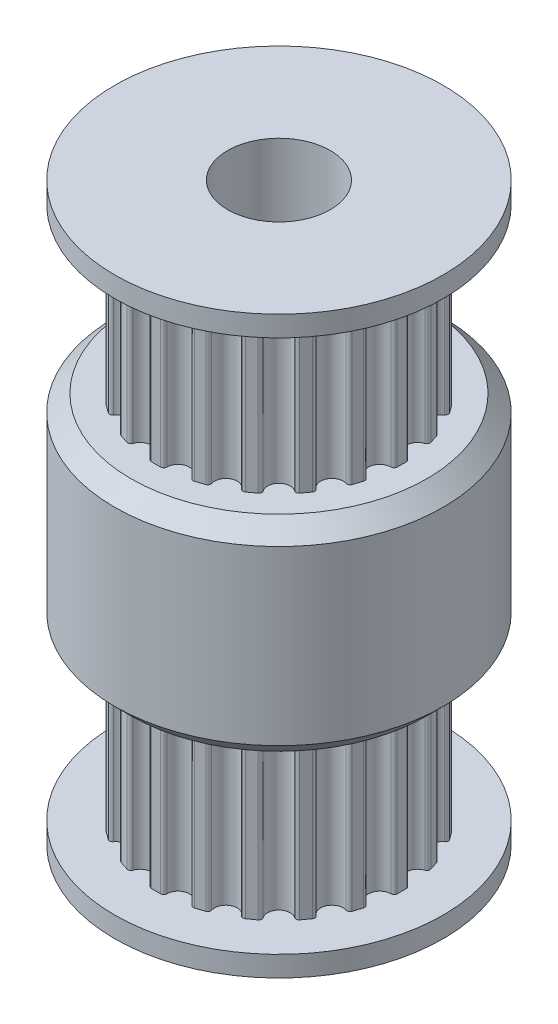
from build123d import *

# Parameters (mm, degrees)
SKETCH1_R             = 8
BOSS_EXTRUDE1_DEPTH   = 5
CHAMFER1_SIZE         = 0.8
SKETCH9_R             = 6.365
BOSS_EXTRUDE2_DEPTH   = 8
CUT_EXTRUDE6_DEPTH    = 8
CIRPATTERN1_COUNT     = 20
SKETCH11_R            = 6.365
BOSS_EXTRUDE3_DEPTH   = 8
MIRROR2_COPY_1_DEPTH  = 8
MIRROR2_COPY_2_DEPTH  = 8
MIRROR2_COPY_3_DEPTH  = 8
MIRROR2_COPY_4_DEPTH  = 8
MIRROR2_COPY_5_DEPTH  = 8
MIRROR2_COPY_6_DEPTH  = 8
MIRROR2_COPY_7_DEPTH  = 8
MIRROR2_COPY_8_DEPTH  = 8
MIRROR2_COPY_9_DEPTH  = 8
MIRROR2_COPY_10_DEPTH = 8
MIRROR2_COPY_11_DEPTH = 8
MIRROR2_COPY_12_DEPTH = 8
MIRROR2_COPY_13_DEPTH = 8
MIRROR2_COPY_14_DEPTH = 8
MIRROR2_COPY_15_DEPTH = 8
MIRROR2_COPY_16_DEPTH = 8
MIRROR2_COPY_17_DEPTH = 8
MIRROR2_COPY_18_DEPTH = 8
MIRROR2_COPY_19_DEPTH = 8
BOSS_EXTRUDE4_START   = 1
SKETCH14_R            = 8
BOSS_EXTRUDE4_DEPTH   = 1
SKETCH15_R            = 2.5
CUT_EXTRUDE7_DEPTH    = 31.199337741


with BuildPart() as part:
    # Sketch1 → Boss-Extrude1 (new, symmetric)
    with BuildSketch(Plane(origin=(0, 0, 0), x_dir=(1, 0, 0), z_dir=(0, 1, 0))):
        with Locations(Location((0, 0, 0), (0, 0, 270))):
            Circle(SKETCH1_R)
    extrude(amount=BOSS_EXTRUDE1_DEPTH, both=True)

    # Chamfer1
    chamfer1_edges = [part.edges().sort_by_distance(p)[0] for p in [
        (0, -5, -8),
        (0, 5, -8),
    ]]
    chamfer(chamfer1_edges, length=CHAMFER1_SIZE)

    # Sketch9 → Boss-Extrude2 (add)
    with BuildSketch(Plane.XZ.offset(5)):
        with Locations(Location((0, 0, 0), (0, 0, 270))):
            Circle(SKETCH9_R)
    extrude(amount=BOSS_EXTRUDE2_DEPTH)

    # Sketch10 → Cut-Extrude6 (cut)
    with BuildSketch(Plane.XZ.offset(13)):
        with BuildLine():
            Line((0, 5.985), (0.224173209, 5.985))
            ThreePointArc((0.224173209, 5.985), (0.330239226, 5.941066017), (0.374173209, 5.835))
            ThreePointArc((0.374173209, 5.835), (0.838134254, 5.291771413), (1.447254293, 5.665040653))
            ThreePointArc((1.447254293, 5.665040653), (1.521814196, 5.752339083), (1.63626532, 5.761346581))
            Line((1.63626532, 5.761346581), (1.849466711, 5.69207325))
            Line((1.849466711, 5.69207325), (1.966893169, 6.053474726))
            Line((1.966893169, 6.053474726), (1.966893169, 6.074416041))
            Line((1.966893169, 6.074416041), (1.080118182, 6.314949274))
            Line((1.080118182, 6.314949274), (0.924173209, 6.339648531))
            Line((0.924173209, 6.339648531), (0, 6.377658585))
            Line((0, 6.377658585), (0, 6.365))
            Line((0, 6.365), (0, 5.985))
        make_face()
    cut_extrude6 = extrude(amount=-CUT_EXTRUDE6_DEPTH, mode=Mode.SUBTRACT)

    # CirPattern1: Cut-Extrude6 ×20 about axis
    cirpattern1_axis = Axis((0, 0, 0), (0, 1, 0))
    for i in range(1, CIRPATTERN1_COUNT):
        add(cut_extrude6.rotate(cirpattern1_axis, i * 360 / CIRPATTERN1_COUNT), mode=Mode.SUBTRACT)

    # Sketch11 → Boss-Extrude3 (add)
    with BuildSketch(Plane(origin=(0, 5, 0), x_dir=(1, 0, 0), z_dir=(0, 1, 0))):
        with Locations(Location((0, 0, 0), (0, 0, 270))):
            Circle(SKETCH11_R)
    extrude(amount=BOSS_EXTRUDE3_DEPTH)

    # Mirror2: Cut-Extrude6 across plane
    add(cut_extrude6.mirror(Plane.ZX), mode=Mode.SUBTRACT)

    # Mirror2 copy 1 sketch → Mirror2 copy 1 (cut)
    with BuildSketch(Plane(origin=(0, 13, 0), x_dir=(0.9510565162951535, 0, -0.3090169943749474), z_dir=(0, 1, 0))):
        with BuildLine():
            Line((0, -5.985), (0.224173209, -5.985))
            ThreePointArc((0.224173209, -5.985), (0.330239226, -5.941066017), (0.374173209, -5.835))
            ThreePointArc((0.374173209, -5.835), (0.838134254, -5.291771413), (1.447254293, -5.665040653))
            ThreePointArc((1.447254293, -5.665040653), (1.521814196, -5.752339083), (1.63626532, -5.761346581))
            Line((1.63626532, -5.761346581), (1.849466711, -5.69207325))
            Line((1.849466711, -5.69207325), (1.966893169, -6.053474726))
            Line((1.966893169, -6.053474726), (1.966893169, -6.074416041))
            Line((1.966893169, -6.074416041), (1.080118182, -6.314949274))
            Line((1.080118182, -6.314949274), (0.924173209, -6.339648531))
            Line((0.924173209, -6.339648531), (0, -6.377658585))
            Line((0, -6.377658585), (0, -6.365))
            Line((0, -6.365), (0, -5.985))
        make_face()
    extrude(amount=-MIRROR2_COPY_1_DEPTH, mode=Mode.SUBTRACT)

    # Mirror2 copy 2 sketch → Mirror2 copy 2 (cut)
    with BuildSketch(Plane(origin=(0, 13, 0), x_dir=(0.8090169943749475, 0, -0.5877852522924731), z_dir=(0, 1, 0))):
        with BuildLine():
            Line((0, -5.985), (0.224173209, -5.985))
            ThreePointArc((0.224173209, -5.985), (0.330239226, -5.941066017), (0.374173209, -5.835))
            ThreePointArc((0.374173209, -5.835), (0.838134254, -5.291771413), (1.447254293, -5.665040653))
            ThreePointArc((1.447254293, -5.665040653), (1.521814196, -5.752339083), (1.63626532, -5.761346581))
            Line((1.63626532, -5.761346581), (1.849466711, -5.69207325))
            Line((1.849466711, -5.69207325), (1.966893169, -6.053474726))
            Line((1.966893169, -6.053474726), (1.966893169, -6.074416041))
            Line((1.966893169, -6.074416041), (1.080118182, -6.314949274))
            Line((1.080118182, -6.314949274), (0.924173209, -6.339648531))
            Line((0.924173209, -6.339648531), (0, -6.377658585))
            Line((0, -6.377658585), (0, -6.365))
            Line((0, -6.365), (0, -5.985))
        make_face()
    extrude(amount=-MIRROR2_COPY_2_DEPTH, mode=Mode.SUBTRACT)

    # Mirror2 copy 3 sketch → Mirror2 copy 3 (cut)
    with BuildSketch(Plane(origin=(0, 13, 0), x_dir=(0.5877852522924731, 0, -0.8090169943749475), z_dir=(0, 1, 0))):
        with BuildLine():
            Line((0, -5.985), (0.224173209, -5.985))
            ThreePointArc((0.224173209, -5.985), (0.330239226, -5.941066017), (0.374173209, -5.835))
            ThreePointArc((0.374173209, -5.835), (0.838134254, -5.291771413), (1.447254293, -5.665040653))
            ThreePointArc((1.447254293, -5.665040653), (1.521814196, -5.752339083), (1.63626532, -5.761346581))
            Line((1.63626532, -5.761346581), (1.849466711, -5.69207325))
            Line((1.849466711, -5.69207325), (1.966893169, -6.053474726))
            Line((1.966893169, -6.053474726), (1.966893169, -6.074416041))
            Line((1.966893169, -6.074416041), (1.080118182, -6.314949274))
            Line((1.080118182, -6.314949274), (0.924173209, -6.339648531))
            Line((0.924173209, -6.339648531), (0, -6.377658585))
            Line((0, -6.377658585), (0, -6.365))
            Line((0, -6.365), (0, -5.985))
        make_face()
    extrude(amount=-MIRROR2_COPY_3_DEPTH, mode=Mode.SUBTRACT)

    # Mirror2 copy 4 sketch → Mirror2 copy 4 (cut)
    with BuildSketch(Plane(origin=(0, 13, 0), x_dir=(0.30901699437494745, 0, -0.9510565162951535), z_dir=(0, 1, 0))):
        with BuildLine():
            Line((0, -5.985), (0.224173209, -5.985))
            ThreePointArc((0.224173209, -5.985), (0.330239226, -5.941066017), (0.374173209, -5.835))
            ThreePointArc((0.374173209, -5.835), (0.838134254, -5.291771413), (1.447254293, -5.665040653))
            ThreePointArc((1.447254293, -5.665040653), (1.521814196, -5.752339083), (1.63626532, -5.761346581))
            Line((1.63626532, -5.761346581), (1.849466711, -5.69207325))
            Line((1.849466711, -5.69207325), (1.966893169, -6.053474726))
            Line((1.966893169, -6.053474726), (1.966893169, -6.074416041))
            Line((1.966893169, -6.074416041), (1.080118182, -6.314949274))
            Line((1.080118182, -6.314949274), (0.924173209, -6.339648531))
            Line((0.924173209, -6.339648531), (0, -6.377658585))
            Line((0, -6.377658585), (0, -6.365))
            Line((0, -6.365), (0, -5.985))
        make_face()
    extrude(amount=-MIRROR2_COPY_4_DEPTH, mode=Mode.SUBTRACT)

    # Mirror2 copy 5 sketch → Mirror2 copy 5 (cut)
    with BuildSketch(Plane(origin=(0, 13, 0), x_dir=(0, 0, -1), z_dir=(0, 1, 0))):
        with BuildLine():
            Line((0, -5.985), (0.224173209, -5.985))
            ThreePointArc((0.224173209, -5.985), (0.330239226, -5.941066017), (0.374173209, -5.835))
            ThreePointArc((0.374173209, -5.835), (0.838134254, -5.291771413), (1.447254293, -5.665040653))
            ThreePointArc((1.447254293, -5.665040653), (1.521814196, -5.752339083), (1.63626532, -5.761346581))
            Line((1.63626532, -5.761346581), (1.849466711, -5.69207325))
            Line((1.849466711, -5.69207325), (1.966893169, -6.053474726))
            Line((1.966893169, -6.053474726), (1.966893169, -6.074416041))
            Line((1.966893169, -6.074416041), (1.080118182, -6.314949274))
            Line((1.080118182, -6.314949274), (0.924173209, -6.339648531))
            Line((0.924173209, -6.339648531), (0, -6.377658585))
            Line((0, -6.377658585), (0, -6.365))
            Line((0, -6.365), (0, -5.985))
        make_face()
    extrude(amount=-MIRROR2_COPY_5_DEPTH, mode=Mode.SUBTRACT)

    # Mirror2 copy 6 sketch → Mirror2 copy 6 (cut)
    with BuildSketch(Plane(origin=(0, 13, 0), x_dir=(-0.30901699437494734, 0, -0.9510565162951536), z_dir=(0, 1, 0))):
        with BuildLine():
            Line((0, -5.985), (0.224173209, -5.985))
            ThreePointArc((0.224173209, -5.985), (0.330239226, -5.941066017), (0.374173209, -5.835))
            ThreePointArc((0.374173209, -5.835), (0.838134254, -5.291771413), (1.447254293, -5.665040653))
            ThreePointArc((1.447254293, -5.665040653), (1.521814196, -5.752339083), (1.63626532, -5.761346581))
            Line((1.63626532, -5.761346581), (1.849466711, -5.69207325))
            Line((1.849466711, -5.69207325), (1.966893169, -6.053474726))
            Line((1.966893169, -6.053474726), (1.966893169, -6.074416041))
            Line((1.966893169, -6.074416041), (1.080118182, -6.314949274))
            Line((1.080118182, -6.314949274), (0.924173209, -6.339648531))
            Line((0.924173209, -6.339648531), (0, -6.377658585))
            Line((0, -6.377658585), (0, -6.365))
            Line((0, -6.365), (0, -5.985))
        make_face()
    extrude(amount=-MIRROR2_COPY_6_DEPTH, mode=Mode.SUBTRACT)

    # Mirror2 copy 7 sketch → Mirror2 copy 7 (cut)
    with BuildSketch(Plane(origin=(0, 13, 0), x_dir=(-0.587785252292473, 0, -0.8090169943749475), z_dir=(0, 1, 0))):
        with BuildLine():
            Line((0, -5.985), (0.224173209, -5.985))
            ThreePointArc((0.224173209, -5.985), (0.330239226, -5.941066017), (0.374173209, -5.835))
            ThreePointArc((0.374173209, -5.835), (0.838134254, -5.291771413), (1.447254293, -5.665040653))
            ThreePointArc((1.447254293, -5.665040653), (1.521814196, -5.752339083), (1.63626532, -5.761346581))
            Line((1.63626532, -5.761346581), (1.849466711, -5.69207325))
            Line((1.849466711, -5.69207325), (1.966893169, -6.053474726))
            Line((1.966893169, -6.053474726), (1.966893169, -6.074416041))
            Line((1.966893169, -6.074416041), (1.080118182, -6.314949274))
            Line((1.080118182, -6.314949274), (0.924173209, -6.339648531))
            Line((0.924173209, -6.339648531), (0, -6.377658585))
            Line((0, -6.377658585), (0, -6.365))
            Line((0, -6.365), (0, -5.985))
        make_face()
    extrude(amount=-MIRROR2_COPY_7_DEPTH, mode=Mode.SUBTRACT)

    # Mirror2 copy 8 sketch → Mirror2 copy 8 (cut)
    with BuildSketch(Plane(origin=(0, 13, 0), x_dir=(-0.8090169943749473, 0, -0.5877852522924732), z_dir=(0, 1, 0))):
        with BuildLine():
            Line((0, -5.985), (0.224173209, -5.985))
            ThreePointArc((0.224173209, -5.985), (0.330239226, -5.941066017), (0.374173209, -5.835))
            ThreePointArc((0.374173209, -5.835), (0.838134254, -5.291771413), (1.447254293, -5.665040653))
            ThreePointArc((1.447254293, -5.665040653), (1.521814196, -5.752339083), (1.63626532, -5.761346581))
            Line((1.63626532, -5.761346581), (1.849466711, -5.69207325))
            Line((1.849466711, -5.69207325), (1.966893169, -6.053474726))
            Line((1.966893169, -6.053474726), (1.966893169, -6.074416041))
            Line((1.966893169, -6.074416041), (1.080118182, -6.314949274))
            Line((1.080118182, -6.314949274), (0.924173209, -6.339648531))
            Line((0.924173209, -6.339648531), (0, -6.377658585))
            Line((0, -6.377658585), (0, -6.365))
            Line((0, -6.365), (0, -5.985))
        make_face()
    extrude(amount=-MIRROR2_COPY_8_DEPTH, mode=Mode.SUBTRACT)

    # Mirror2 copy 9 sketch → Mirror2 copy 9 (cut)
    with BuildSketch(Plane(origin=(0, 13, 0), x_dir=(-0.9510565162951535, 0, -0.3090169943749475), z_dir=(0, 1, 0))):
        with BuildLine():
            Line((0, -5.985), (0.224173209, -5.985))
            ThreePointArc((0.224173209, -5.985), (0.330239226, -5.941066017), (0.374173209, -5.835))
            ThreePointArc((0.374173209, -5.835), (0.838134254, -5.291771413), (1.447254293, -5.665040653))
            ThreePointArc((1.447254293, -5.665040653), (1.521814196, -5.752339083), (1.63626532, -5.761346581))
            Line((1.63626532, -5.761346581), (1.849466711, -5.69207325))
            Line((1.849466711, -5.69207325), (1.966893169, -6.053474726))
            Line((1.966893169, -6.053474726), (1.966893169, -6.074416041))
            Line((1.966893169, -6.074416041), (1.080118182, -6.314949274))
            Line((1.080118182, -6.314949274), (0.924173209, -6.339648531))
            Line((0.924173209, -6.339648531), (0, -6.377658585))
            Line((0, -6.377658585), (0, -6.365))
            Line((0, -6.365), (0, -5.985))
        make_face()
    extrude(amount=-MIRROR2_COPY_9_DEPTH, mode=Mode.SUBTRACT)

    # Mirror2 copy 10 sketch → Mirror2 copy 10 (cut)
    with BuildSketch(Plane(origin=(0, 13, 0), x_dir=(-1, 0, 0), z_dir=(0, 1, 0))):
        with BuildLine():
            Line((0, -5.985), (0.224173209, -5.985))
            ThreePointArc((0.224173209, -5.985), (0.330239226, -5.941066017), (0.374173209, -5.835))
            ThreePointArc((0.374173209, -5.835), (0.838134254, -5.291771413), (1.447254293, -5.665040653))
            ThreePointArc((1.447254293, -5.665040653), (1.521814196, -5.752339083), (1.63626532, -5.761346581))
            Line((1.63626532, -5.761346581), (1.849466711, -5.69207325))
            Line((1.849466711, -5.69207325), (1.966893169, -6.053474726))
            Line((1.966893169, -6.053474726), (1.966893169, -6.074416041))
            Line((1.966893169, -6.074416041), (1.080118182, -6.314949274))
            Line((1.080118182, -6.314949274), (0.924173209, -6.339648531))
            Line((0.924173209, -6.339648531), (0, -6.377658585))
            Line((0, -6.377658585), (0, -6.365))
            Line((0, -6.365), (0, -5.985))
        make_face()
    extrude(amount=-MIRROR2_COPY_10_DEPTH, mode=Mode.SUBTRACT)

    # Mirror2 copy 11 sketch → Mirror2 copy 11 (cut)
    with BuildSketch(Plane(origin=(0, 13, 0), x_dir=(-0.9510565162951536, 0, 0.3090169943749473), z_dir=(0, 1, 0))):
        with BuildLine():
            Line((0, -5.985), (0.224173209, -5.985))
            ThreePointArc((0.224173209, -5.985), (0.330239226, -5.941066017), (0.374173209, -5.835))
            ThreePointArc((0.374173209, -5.835), (0.838134254, -5.291771413), (1.447254293, -5.665040653))
            ThreePointArc((1.447254293, -5.665040653), (1.521814196, -5.752339083), (1.63626532, -5.761346581))
            Line((1.63626532, -5.761346581), (1.849466711, -5.69207325))
            Line((1.849466711, -5.69207325), (1.966893169, -6.053474726))
            Line((1.966893169, -6.053474726), (1.966893169, -6.074416041))
            Line((1.966893169, -6.074416041), (1.080118182, -6.314949274))
            Line((1.080118182, -6.314949274), (0.924173209, -6.339648531))
            Line((0.924173209, -6.339648531), (0, -6.377658585))
            Line((0, -6.377658585), (0, -6.365))
            Line((0, -6.365), (0, -5.985))
        make_face()
    extrude(amount=-MIRROR2_COPY_11_DEPTH, mode=Mode.SUBTRACT)

    # Mirror2 copy 12 sketch → Mirror2 copy 12 (cut)
    with BuildSketch(Plane(origin=(0, 13, 0), x_dir=(-0.8090169943749476, 0, 0.587785252292473), z_dir=(0, 1, 0))):
        with BuildLine():
            Line((0, -5.985), (0.224173209, -5.985))
            ThreePointArc((0.224173209, -5.985), (0.330239226, -5.941066017), (0.374173209, -5.835))
            ThreePointArc((0.374173209, -5.835), (0.838134254, -5.291771413), (1.447254293, -5.665040653))
            ThreePointArc((1.447254293, -5.665040653), (1.521814196, -5.752339083), (1.63626532, -5.761346581))
            Line((1.63626532, -5.761346581), (1.849466711, -5.69207325))
            Line((1.849466711, -5.69207325), (1.966893169, -6.053474726))
            Line((1.966893169, -6.053474726), (1.966893169, -6.074416041))
            Line((1.966893169, -6.074416041), (1.080118182, -6.314949274))
            Line((1.080118182, -6.314949274), (0.924173209, -6.339648531))
            Line((0.924173209, -6.339648531), (0, -6.377658585))
            Line((0, -6.377658585), (0, -6.365))
            Line((0, -6.365), (0, -5.985))
        make_face()
    extrude(amount=-MIRROR2_COPY_12_DEPTH, mode=Mode.SUBTRACT)

    # Mirror2 copy 13 sketch → Mirror2 copy 13 (cut)
    with BuildSketch(Plane(origin=(0, 13, 0), x_dir=(-0.5877852522924732, 0, 0.8090169943749473), z_dir=(0, 1, 0))):
        with BuildLine():
            Line((0, -5.985), (0.224173209, -5.985))
            ThreePointArc((0.224173209, -5.985), (0.330239226, -5.941066017), (0.374173209, -5.835))
            ThreePointArc((0.374173209, -5.835), (0.838134254, -5.291771413), (1.447254293, -5.665040653))
            ThreePointArc((1.447254293, -5.665040653), (1.521814196, -5.752339083), (1.63626532, -5.761346581))
            Line((1.63626532, -5.761346581), (1.849466711, -5.69207325))
            Line((1.849466711, -5.69207325), (1.966893169, -6.053474726))
            Line((1.966893169, -6.053474726), (1.966893169, -6.074416041))
            Line((1.966893169, -6.074416041), (1.080118182, -6.314949274))
            Line((1.080118182, -6.314949274), (0.924173209, -6.339648531))
            Line((0.924173209, -6.339648531), (0, -6.377658585))
            Line((0, -6.377658585), (0, -6.365))
            Line((0, -6.365), (0, -5.985))
        make_face()
    extrude(amount=-MIRROR2_COPY_13_DEPTH, mode=Mode.SUBTRACT)

    # Mirror2 copy 14 sketch → Mirror2 copy 14 (cut)
    with BuildSketch(Plane(origin=(0, 13, 0), x_dir=(-0.30901699437494756, 0, 0.9510565162951535), z_dir=(0, 1, 0))):
        with BuildLine():
            Line((0, -5.985), (0.224173209, -5.985))
            ThreePointArc((0.224173209, -5.985), (0.330239226, -5.941066017), (0.374173209, -5.835))
            ThreePointArc((0.374173209, -5.835), (0.838134254, -5.291771413), (1.447254293, -5.665040653))
            ThreePointArc((1.447254293, -5.665040653), (1.521814196, -5.752339083), (1.63626532, -5.761346581))
            Line((1.63626532, -5.761346581), (1.849466711, -5.69207325))
            Line((1.849466711, -5.69207325), (1.966893169, -6.053474726))
            Line((1.966893169, -6.053474726), (1.966893169, -6.074416041))
            Line((1.966893169, -6.074416041), (1.080118182, -6.314949274))
            Line((1.080118182, -6.314949274), (0.924173209, -6.339648531))
            Line((0.924173209, -6.339648531), (0, -6.377658585))
            Line((0, -6.377658585), (0, -6.365))
            Line((0, -6.365), (0, -5.985))
        make_face()
    extrude(amount=-MIRROR2_COPY_14_DEPTH, mode=Mode.SUBTRACT)

    # Mirror2 copy 15 sketch → Mirror2 copy 15 (cut)
    with BuildSketch(Plane.ZX.offset(13)):
        with BuildLine():
            Line((0, -5.985), (0.224173209, -5.985))
            ThreePointArc((0.224173209, -5.985), (0.330239226, -5.941066017), (0.374173209, -5.835))
            ThreePointArc((0.374173209, -5.835), (0.838134254, -5.291771413), (1.447254293, -5.665040653))
            ThreePointArc((1.447254293, -5.665040653), (1.521814196, -5.752339083), (1.63626532, -5.761346581))
            Line((1.63626532, -5.761346581), (1.849466711, -5.69207325))
            Line((1.849466711, -5.69207325), (1.966893169, -6.053474726))
            Line((1.966893169, -6.053474726), (1.966893169, -6.074416041))
            Line((1.966893169, -6.074416041), (1.080118182, -6.314949274))
            Line((1.080118182, -6.314949274), (0.924173209, -6.339648531))
            Line((0.924173209, -6.339648531), (0, -6.377658585))
            Line((0, -6.377658585), (0, -6.365))
            Line((0, -6.365), (0, -5.985))
        make_face()
    extrude(amount=-MIRROR2_COPY_15_DEPTH, mode=Mode.SUBTRACT)

    # Mirror2 copy 16 sketch → Mirror2 copy 16 (cut)
    with BuildSketch(Plane(origin=(0, 13, 0), x_dir=(0.30901699437494723, 0, 0.9510565162951536), z_dir=(0, 1, 0))):
        with BuildLine():
            Line((0, -5.985), (0.224173209, -5.985))
            ThreePointArc((0.224173209, -5.985), (0.330239226, -5.941066017), (0.374173209, -5.835))
            ThreePointArc((0.374173209, -5.835), (0.838134254, -5.291771413), (1.447254293, -5.665040653))
            ThreePointArc((1.447254293, -5.665040653), (1.521814196, -5.752339083), (1.63626532, -5.761346581))
            Line((1.63626532, -5.761346581), (1.849466711, -5.69207325))
            Line((1.849466711, -5.69207325), (1.966893169, -6.053474726))
            Line((1.966893169, -6.053474726), (1.966893169, -6.074416041))
            Line((1.966893169, -6.074416041), (1.080118182, -6.314949274))
            Line((1.080118182, -6.314949274), (0.924173209, -6.339648531))
            Line((0.924173209, -6.339648531), (0, -6.377658585))
            Line((0, -6.377658585), (0, -6.365))
            Line((0, -6.365), (0, -5.985))
        make_face()
    extrude(amount=-MIRROR2_COPY_16_DEPTH, mode=Mode.SUBTRACT)

    # Mirror2 copy 17 sketch → Mirror2 copy 17 (cut)
    with BuildSketch(Plane(origin=(0, 13, 0), x_dir=(0.5877852522924729, 0, 0.8090169943749476), z_dir=(0, 1, 0))):
        with BuildLine():
            Line((0, -5.985), (0.224173209, -5.985))
            ThreePointArc((0.224173209, -5.985), (0.330239226, -5.941066017), (0.374173209, -5.835))
            ThreePointArc((0.374173209, -5.835), (0.838134254, -5.291771413), (1.447254293, -5.665040653))
            ThreePointArc((1.447254293, -5.665040653), (1.521814196, -5.752339083), (1.63626532, -5.761346581))
            Line((1.63626532, -5.761346581), (1.849466711, -5.69207325))
            Line((1.849466711, -5.69207325), (1.966893169, -6.053474726))
            Line((1.966893169, -6.053474726), (1.966893169, -6.074416041))
            Line((1.966893169, -6.074416041), (1.080118182, -6.314949274))
            Line((1.080118182, -6.314949274), (0.924173209, -6.339648531))
            Line((0.924173209, -6.339648531), (0, -6.377658585))
            Line((0, -6.377658585), (0, -6.365))
            Line((0, -6.365), (0, -5.985))
        make_face()
    extrude(amount=-MIRROR2_COPY_17_DEPTH, mode=Mode.SUBTRACT)

    # Mirror2 copy 18 sketch → Mirror2 copy 18 (cut)
    with BuildSketch(Plane(origin=(0, 13, 0), x_dir=(0.8090169943749473, 0, 0.5877852522924734), z_dir=(0, 1, 0))):
        with BuildLine():
            Line((0, -5.985), (0.224173209, -5.985))
            ThreePointArc((0.224173209, -5.985), (0.330239226, -5.941066017), (0.374173209, -5.835))
            ThreePointArc((0.374173209, -5.835), (0.838134254, -5.291771413), (1.447254293, -5.665040653))
            ThreePointArc((1.447254293, -5.665040653), (1.521814196, -5.752339083), (1.63626532, -5.761346581))
            Line((1.63626532, -5.761346581), (1.849466711, -5.69207325))
            Line((1.849466711, -5.69207325), (1.966893169, -6.053474726))
            Line((1.966893169, -6.053474726), (1.966893169, -6.074416041))
            Line((1.966893169, -6.074416041), (1.080118182, -6.314949274))
            Line((1.080118182, -6.314949274), (0.924173209, -6.339648531))
            Line((0.924173209, -6.339648531), (0, -6.377658585))
            Line((0, -6.377658585), (0, -6.365))
            Line((0, -6.365), (0, -5.985))
        make_face()
    extrude(amount=-MIRROR2_COPY_18_DEPTH, mode=Mode.SUBTRACT)

    # Mirror2 copy 19 sketch → Mirror2 copy 19 (cut)
    with BuildSketch(Plane(origin=(0, 13, 0), x_dir=(0.9510565162951535, 0, 0.3090169943749476), z_dir=(0, 1, 0))):
        with BuildLine():
            Line((0, -5.985), (0.224173209, -5.985))
            ThreePointArc((0.224173209, -5.985), (0.330239226, -5.941066017), (0.374173209, -5.835))
            ThreePointArc((0.374173209, -5.835), (0.838134254, -5.291771413), (1.447254293, -5.665040653))
            ThreePointArc((1.447254293, -5.665040653), (1.521814196, -5.752339083), (1.63626532, -5.761346581))
            Line((1.63626532, -5.761346581), (1.849466711, -5.69207325))
            Line((1.849466711, -5.69207325), (1.966893169, -6.053474726))
            Line((1.966893169, -6.053474726), (1.966893169, -6.074416041))
            Line((1.966893169, -6.074416041), (1.080118182, -6.314949274))
            Line((1.080118182, -6.314949274), (0.924173209, -6.339648531))
            Line((0.924173209, -6.339648531), (0, -6.377658585))
            Line((0, -6.377658585), (0, -6.365))
            Line((0, -6.365), (0, -5.985))
        make_face()
    extrude(amount=-MIRROR2_COPY_19_DEPTH, mode=Mode.SUBTRACT)

    # Sketch14 → Boss-Extrude4 (add)
    with BuildSketch(Plane(origin=(0, 13, 0), x_dir=(1, 0, 0), z_dir=(0, 1, 0)).offset(BOSS_EXTRUDE4_START)):
        with Locations(Location((0, 0, 0), (0, 0, 270))):
            Circle(SKETCH14_R)
    boss_extrude4 = extrude(amount=-BOSS_EXTRUDE4_DEPTH)

    # Mirror3: Boss-Extrude4 across plane
    add(boss_extrude4.mirror(Plane.ZX))

    # Sketch15 → Cut-Extrude7 (cut, through all)
    with BuildSketch(Plane(origin=(0, 14, 0), x_dir=(1, 0, 0), z_dir=(0, 1, 0))):
        with Locations(Location((0, 0, 0), (0, 0, 270))):
            Circle(SKETCH15_R)
    extrude(amount=-CUT_EXTRUDE7_DEPTH, mode=Mode.SUBTRACT)


solid = part.part
